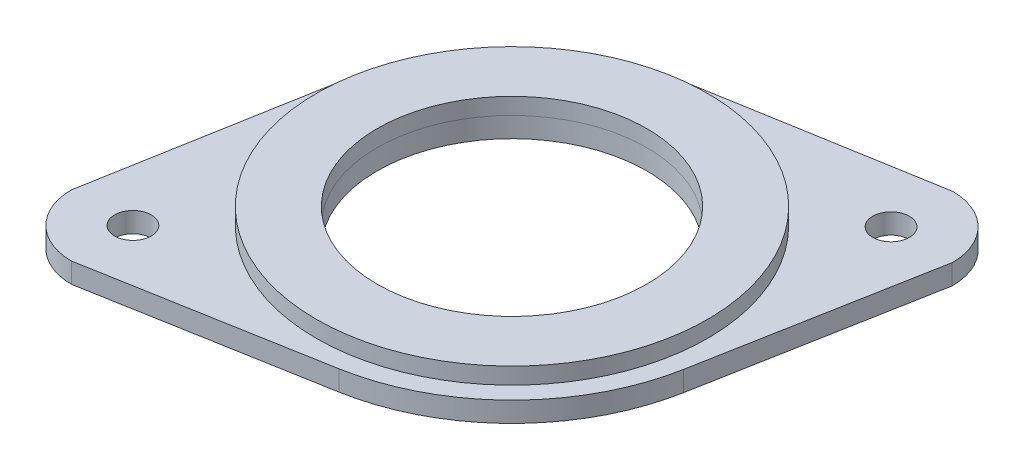
from build123d import *

# Parameters (mm, degrees)
SKETCH1_R           = 1500
SKETCH1_R_2         = 11025
BOSS_EXTRUDE1_DEPTH = 1650
SKETCH2_R           = 16000
SKETCH2_R_2         = 11025
BOSS_EXTRUDE2_DEPTH = 1350
SCALE2_SCALE        = 0.001


with BuildPart() as part:
    # Sketch1 → Boss-Extrude1 (new body)
    with BuildSketch(Plane(origin=(0, 0, 0), x_dir=(1, 0, 0), z_dir=(0, 1, 0))):
        with BuildLine():
            Line((17209.305722817, -3176.444009941), (20632.540093335, 15369.919992931))
            ThreePointArc((20632.540093335, 15369.919992931), (19180.351834931, 18939.449717944), (15629.46099565, 20436.636227071))
            Line((15629.46099565, 20436.636227071), (-2958.686933947, 17248.077331592))
            ThreePointArc((-2958.686933947, 17248.077331592), (-12335.206917505, 12413.406877728), (-17229.035558487, 3067.626726653))
            Line((-17229.035558487, 3067.626726653), (-20534.998205313, -15500))
            ThreePointArc((-20534.998205313, -15500), (-19060.281374239, -19060.281374239), (-15500, -20534.998205312))
            Line((-15500, -20534.998205312), (3067.626726653, -17229.035558487))
            ThreePointArc((3067.626726653, -17229.035558487), (8019.775569124, -15554.201999156), (12256.263323125, -12491.357386765))
            ThreePointArc((12256.263323125, -12491.357386765), (12335.206917505, -12413.406877728), (12413.654752449, -12334.957466351))
            ThreePointArc((12413.654752449, -12334.957466351), (15503.210603375, -8117.909890919), (17209.305722817, -3176.444009941))
        make_face()
        with Locations(Location((-15500, -15500, 0), (0, 0, 270))):
            Circle(SKETCH1_R, mode=Mode.SUBTRACT)
        with Locations(Location((0, 0, 0), (0, 0, 270))):
            Circle(SKETCH1_R_2, mode=Mode.SUBTRACT)
        with Locations(Location((15597.642427422, 15401.738561158, 0), (0, 0, 270))):
            Circle(SKETCH1_R, mode=Mode.SUBTRACT)
    extrude(amount=BOSS_EXTRUDE1_DEPTH)


with BuildPart() as body_2:
    # Sketch2 → Boss-Extrude2 (new body)
    with BuildSketch(Plane(origin=(0, 1650, 0), x_dir=(1, 0, 0), z_dir=(0, 1, 0))):
        with Locations(Location((0, 0, 0), (0, 0, 270))):
            Circle(SKETCH2_R)
        with Locations(Location((0, 0, 0), (0, 0, 270))):
            Circle(SKETCH2_R_2, mode=Mode.SUBTRACT)
    extrude(amount=BOSS_EXTRUDE2_DEPTH)


with BuildPart() as body_2_1:
    # Scale2: scaled about (0, 0, 0)
    add(body_2.part.scale(SCALE2_SCALE))


with BuildPart() as part_1:
    # Scale2: scaled about (0, 0, 0)
    add(part.part.scale(SCALE2_SCALE))


solid = Compound([body_2_1.part, part_1.part])
